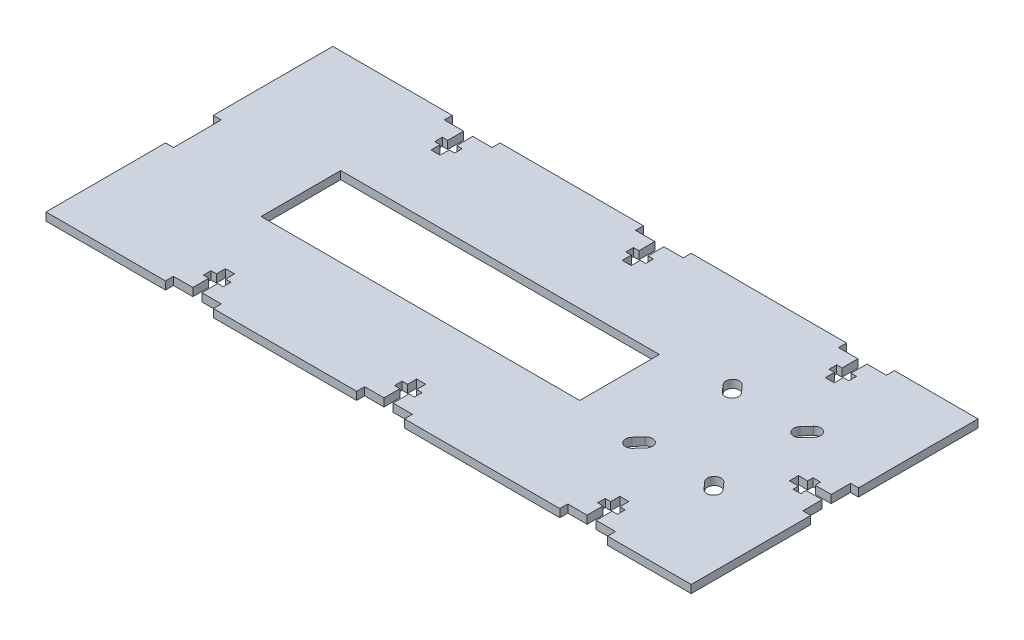
from build123d import *

# Parameters (mm, degrees)
BOSS_EXTRUDE1_DEPTH = 2.54
CUT_EXTRUDE1_REACH  = 114.601
CUT_EXTRUDE2_REACH  = 114.601
SKETCH4_W           = 101.6
SKETCH4_H           = 25.4


with BuildPart() as part:
    # Sketch2 → Boss-Extrude1 (new body)
    with BuildSketch(Plane(origin=(0, 0, 0), x_dir=(1, 0, 0), z_dir=(0, 1, 0))):
        Polygon((-102.87, -45.72), (-64.77, -45.72), (-64.77, -43.18), (-58.5978, -43.18), (-58.5978, -38.1), (-60.325, -38.1), (-60.325, -35.66795), (-58.5978, -35.66795), (-58.5978, -32.766), (-55.7022, -32.766), (-55.7022, -35.66795), (-53.975, -35.66795), (-53.975, -38.1), (-55.7022, -38.1), (-55.7022, -43.18), (-49.53, -43.18), (-49.53, -45.72), (-3.81, -45.72), (-3.81, -43.18), (2.3622, -43.18), (2.3622, -38.1), (0.635, -38.1), (0.635, -35.66795), (2.3622, -35.66795), (2.3622, -32.766), (5.2578, -32.766), (5.2578, -35.66795), (6.985, -35.66795), (6.985, -38.1), (5.2578, -38.1), (5.2578, -43.18), (11.43, -43.18), (11.43, -45.72), (60.96, -45.72), (60.96, -43.18), (67.1322, -43.18), (67.1322, -38.1), (65.405, -38.1), (65.405, -35.66795), (67.1322, -35.66795), (67.1322, -32.766), (70.0278, -32.766), (70.0278, -35.66795), (71.755, -35.66795), (71.755, -38.1), (70.0278, -38.1), (70.0278, -43.18), (76.2, -43.18), (76.2, -45.72), (102.87, -45.72), (102.87, -7.62), (100.33, -7.62), (100.33, -1.4478), (95.25, -1.4478), (95.25, -3.175), (92.81795, -3.175), (92.81795, -1.4478), (89.916, -1.4478), (89.916, 1.4478), (92.81795, 1.4478), (92.81795, 3.175), (95.25, 3.175), (95.25, 1.4478), (100.33, 1.4478), (100.33, 7.62), (102.87, 7.62), (102.87, 45.72), (76.2, 45.72), (76.2, 43.18), (70.0278, 43.18), (70.0278, 38.1), (71.755, 38.1), (71.755, 35.66795), (70.0278, 35.66795), (70.0278, 32.766), (67.1322, 32.766), (67.1322, 35.66795), (65.405, 35.66795), (65.405, 38.1), (67.1322, 38.1), (67.1322, 43.18), (60.96, 43.18), (60.96, 45.72), (11.43, 45.72), (11.43, 43.18), (5.2578, 43.18), (5.2578, 38.1), (6.985, 38.1), (6.985, 35.66795), (5.2578, 35.66795), (5.2578, 32.766), (2.3622, 32.766), (2.3622, 35.66795), (0.635, 35.66795), (0.635, 38.1), (2.3622, 38.1), (2.3622, 43.18), (-3.81, 43.18), (-3.81, 45.72), (-49.53, 45.72), (-49.53, 43.18), (-55.7022, 43.18), (-55.7022, 38.1), (-53.975, 38.1), (-53.975, 35.66795), (-55.7022, 35.66795), (-55.7022, 32.766), (-58.5978, 32.766), (-58.5978, 35.66795), (-60.325, 35.66795), (-60.325, 38.1), (-58.5978, 38.1), (-58.5978, 43.18), (-64.77, 43.18), (-64.77, 45.72), (-102.87, 45.72), (-102.87, 7.62), (-100.33, 7.62), (-100.33, -7.62), (-102.87, -7.62), align=None)
    extrude(amount=-BOSS_EXTRUDE1_DEPTH)

    # Sketch3 → Cut-Extrude1 (cut, up to next)
    with BuildSketch(Plane(origin=(0, 0, 0), x_dir=(1, 0, 0), z_dir=(0, 1, 0)), mode=Mode.PRIVATE) as cut_extrude1_sk1:
        with BuildLine():
            Line((81.873223588, 14.562666667), (79.841223588, 12.290821602))
            ThreePointArc((79.841223588, 12.290821602), (76.792666667, 12.120931347), (76.622776412, 15.169488268))
            Line((76.622776412, 15.169488268), (78.654776412, 17.441333333))
            ThreePointArc((78.654776412, 17.441333333), (81.703333333, 17.611223588), (81.873223588, 14.562666667))
        make_face()
    cut_extrude1_tool1 = extrude(cut_extrude1_sk1.sketch, amount=-CUT_EXTRUDE1_REACH, mode=Mode.PRIVATE) & part.part
    # Sketch3 → Cut-Extrude1 (cut, up to next)
    with BuildSketch(Plane(origin=(0, 0, 0), x_dir=(1, 0, 0), z_dir=(0, 1, 0)), mode=Mode.PRIVATE) as cut_extrude1_sk2:
        with BuildLine():
            Line((52.746776412, 14.562666667), (54.778776412, 12.290821602))
            ThreePointArc((54.778776412, 12.290821602), (57.827333333, 12.120931347), (57.997223588, 15.169488268))
            Line((57.997223588, 15.169488268), (55.965223588, 17.441333333))
            ThreePointArc((55.965223588, 17.441333333), (52.916666667, 17.611223588), (52.746776412, 14.562666667))
        make_face()
    cut_extrude1_tool2 = extrude(cut_extrude1_sk2.sketch, amount=-CUT_EXTRUDE1_REACH, mode=Mode.PRIVATE) & part.part
    # Sketch3 → Cut-Extrude1 (cut, up to next)
    with BuildSketch(Plane(origin=(0, 0, 0), x_dir=(1, 0, 0), z_dir=(0, 1, 0)), mode=Mode.PRIVATE) as cut_extrude1_sk3:
        with BuildLine():
            Line((81.873223588, -14.562666667), (79.841223588, -12.290821602))
            ThreePointArc((79.841223588, -12.290821602), (76.792666667, -12.120931347), (76.622776412, -15.169488268))
            Line((76.622776412, -15.169488268), (78.654776412, -17.441333333))
            ThreePointArc((78.654776412, -17.441333333), (81.703333333, -17.611223588), (81.873223588, -14.562666667))
        make_face()
    cut_extrude1_tool3 = extrude(cut_extrude1_sk3.sketch, amount=-CUT_EXTRUDE1_REACH, mode=Mode.PRIVATE) & part.part
    # Sketch3 → Cut-Extrude1 (cut, up to next)
    with BuildSketch(Plane(origin=(0, 0, 0), x_dir=(1, 0, 0), z_dir=(0, 1, 0)), mode=Mode.PRIVATE) as cut_extrude1_sk4:
        with BuildLine():
            Line((52.746776412, -14.562666667), (54.778776412, -12.290821602))
            ThreePointArc((54.778776412, -12.290821602), (57.827333333, -12.120931347), (57.997223588, -15.169488268))
            Line((57.997223588, -15.169488268), (55.965223588, -17.441333333))
            ThreePointArc((55.965223588, -17.441333333), (52.916666667, -17.611223588), (52.746776412, -14.562666667))
        make_face()
    cut_extrude1_tool4 = extrude(cut_extrude1_sk4.sketch, amount=-CUT_EXTRUDE1_REACH, mode=Mode.PRIVATE) & part.part
    add(cut_extrude1_tool1.solids().sort_by_distance((79.248, 0, -14.866077))[0], mode=Mode.SUBTRACT)
    add(cut_extrude1_tool2.solids().sort_by_distance((55.372, 0, -14.866077))[0], mode=Mode.SUBTRACT)
    add(cut_extrude1_tool3.solids().sort_by_distance((79.248, 0, 14.866077))[0], mode=Mode.SUBTRACT)
    add(cut_extrude1_tool4.solids().sort_by_distance((55.372, 0, 14.866077))[0], mode=Mode.SUBTRACT)

    # Sketch4 → Cut-Extrude2 (cut, up to next)
    with BuildSketch(Plane(origin=(0, 0, 0), x_dir=(1, 0, 0), z_dir=(0, 1, 0)), mode=Mode.PRIVATE) as cut_extrude2_sk1:
        with Locations((-16.51, 0)):
            Rectangle(SKETCH4_W, SKETCH4_H)
    cut_extrude2_tool1 = extrude(cut_extrude2_sk1.sketch, amount=-CUT_EXTRUDE2_REACH, mode=Mode.PRIVATE) & part.part
    add(cut_extrude2_tool1.solids().sort_by_distance((-16.51, 0, 0))[0], mode=Mode.SUBTRACT)


solid = part.part
